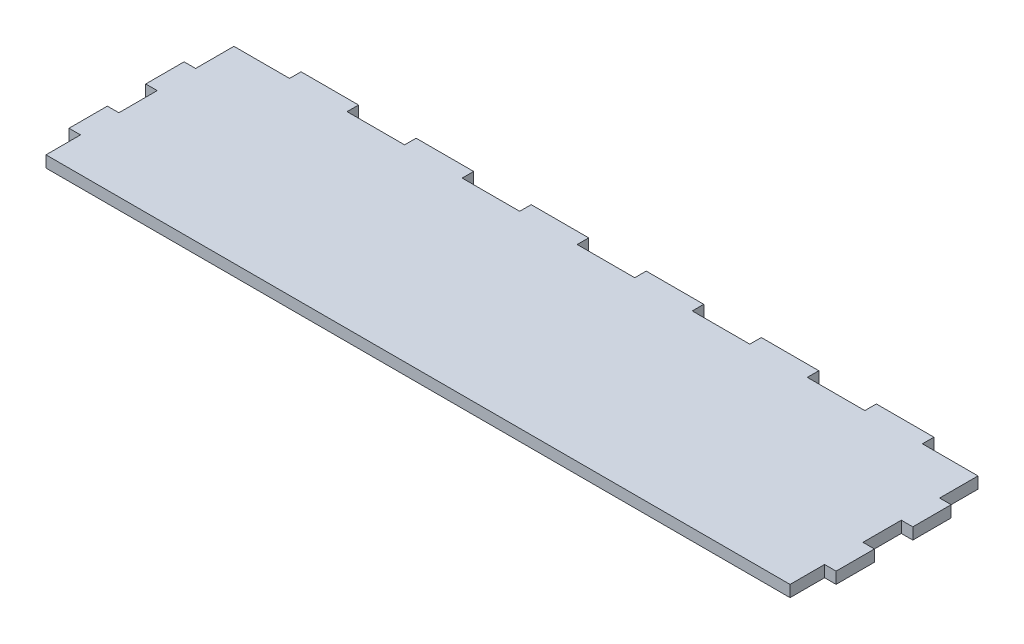
from build123d import *

# Parameters (mm, degrees)
BOSS_EXTRUDE1_DEPTH = 3


with BuildPart() as part:
    # Sketch1 → Boss-Extrude1 (new body)
    with BuildSketch(Plane(origin=(0, 0, 0), x_dir=(1, 0, 0), z_dir=(0, 1, 0))):
        Polygon((15, 0), (0.5, 0), (0.5, -10), (-2.5, -10), (-2.5, -20), (0.5, -20), (0.5, -30), (-2.5, -30), (-2.5, -40), (0.5, -40), (0.5, -49), (194.5, -49), (194.5, -40), (197.5, -40), (197.5, -30), (194.5, -30), (194.5, -20), (197.5, -20), (197.5, -10), (194.5, -10), (194.5, 0), (180, 0), (180, 3), (165, 3), (165, 0), (150, 0), (150, 3), (135, 3), (135, 0), (120, 0), (120, 3), (105, 3), (105, 0), (90, 0), (90, 3), (75, 3), (75, 0), (60, 0), (60, 3), (45, 3), (45, 0), (30, 0), (30, 3), (15, 3), align=None)
    extrude(amount=BOSS_EXTRUDE1_DEPTH)


solid = part.part
